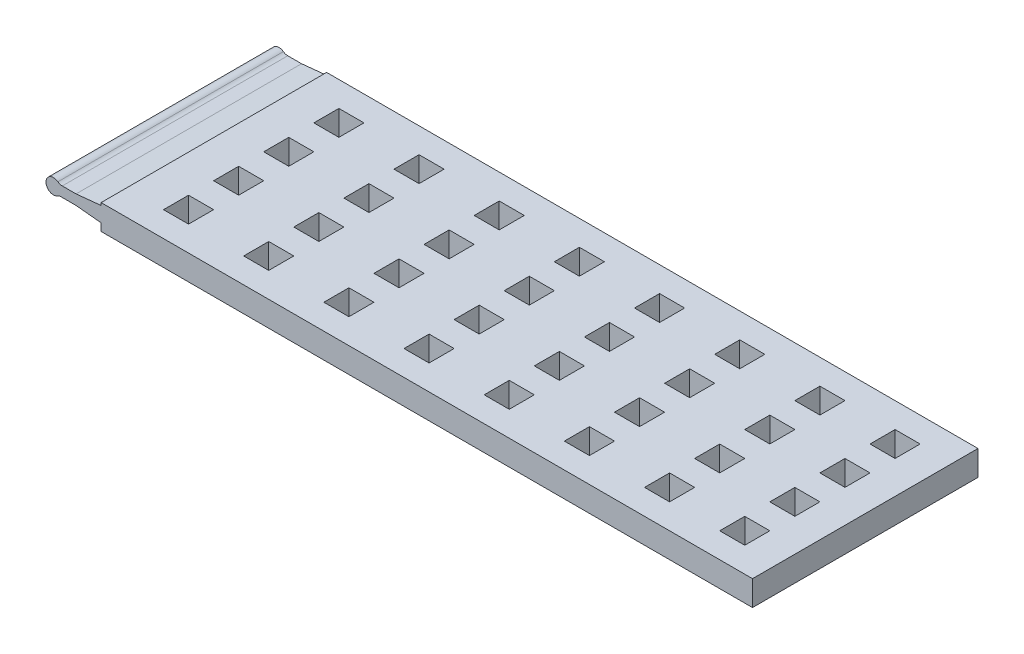
from build123d import *

# Parameters (mm, degrees)
SKETCH1_W           = 215
SKETCH1_H           = 90
BOSS_EXTRUDE1_DEPTH = 5
CUT_EXTRUDE2_DEPTH  = 146.187632354
SKETCH7_W           = 90
SKETCH7_H           = 10
BOSS_EXTRUDE3_DEPTH = 70
SKETCH8_W           = 10
SKETCH8_H           = 10
CUT_EXTRUDE4_DEPTH  = 38


with BuildPart() as part:
    # Sketch1 → Boss-Extrude1 (new, symmetric)
    with BuildSketch(Plane(origin=(0, 0, 0), x_dir=(1, 0, 0), z_dir=(0, 1, 0))):
        with Locations((6.317611065, 0.819935691)):
            Rectangle(SKETCH1_W, SKETCH1_H)
    extrude(amount=BOSS_EXTRUDE1_DEPTH, both=True)

    # Sketch3 → Cut-Extrude2 (cut, through all)
    with BuildSketch(Plane.XY.offset(44.180064309)):
        with BuildLine():
            Line((-101.182388935, -5), (-76.182388935, -5))
            Line((-76.182388935, -5), (-76.182388935, -2))
            Line((-76.182388935, -2), (-86.182388935, -1))
            Line((-86.182388935, -1), (-92.067313838, -1))
            ThreePointArc((-92.067313838, -1), (-92.876019978, -1.111056529), (-93.624851386, -1.436003747))
            ThreePointArc((-93.624851386, -1.436003747), (-98.180146552, 1.243963481), (-93.431421846, 3.563996253))
            ThreePointArc((-93.431421846, 3.563996253), (-92.600234286, 3.144478048), (-91.680454758, 3))
            Line((-91.680454758, 3), (-86.182388935, 3))
            Line((-86.182388935, 3), (-76.182388935, 4))
            Line((-76.182388935, 4), (-76.182388935, 5))
            Line((-76.182388935, 5), (-101.182388935, 5))
            Line((-101.182388935, 5), (-101.182388935, -5))
        make_face()
    extrude(amount=-CUT_EXTRUDE2_DEPTH, mode=Mode.SUBTRACT)

    # Sketch7 → Boss-Extrude3 (add)
    with BuildSketch(Plane(origin=(113.817611065, 0, 0), x_dir=(0, 0, -1), z_dir=(1, 0, 0))):
        with Locations((0.819935691, 0)):
            Rectangle(SKETCH7_W, SKETCH7_H)
    extrude(amount=BOSS_EXTRUDE3_DEPTH)

    # Sketch8 → Cut-Extrude4 (cut)
    with BuildSketch(Plane(origin=(0, 5, 0), x_dir=(1, 0, 0), z_dir=(0, 1, 0))):
        with Locations((-24.27998453, -29.180064309)):
            Rectangle(SKETCH8_W, SKETCH8_H)
        with Locations((-56.27998453, -29.180064309)):
            Rectangle(SKETCH8_W, SKETCH8_H)
        with Locations((7.72001547, -29.180064309)):
            Rectangle(SKETCH8_W, SKETCH8_H)
        with Locations((39.72001547, -29.180064309)):
            Rectangle(SKETCH8_W, SKETCH8_H)
        with Locations((71.72001547, -29.180064309)):
            Rectangle(SKETCH8_W, SKETCH8_H)
        with Locations((103.72001547, -29.180064309)):
            Rectangle(SKETCH8_W, SKETCH8_H)
        with Locations((135.72001547, -29.180064309)):
            Rectangle(SKETCH8_W, SKETCH8_H)
        with Locations((-24.27998453, -9.180064309)):
            Rectangle(SKETCH8_W, SKETCH8_H)
        with Locations((7.72001547, -9.180064309)):
            Rectangle(SKETCH8_W, SKETCH8_H)
        with Locations((39.72001547, -9.180064309)):
            Rectangle(SKETCH8_W, SKETCH8_H)
        with Locations((71.72001547, -9.180064309)):
            Rectangle(SKETCH8_W, SKETCH8_H)
        with Locations((103.72001547, -9.180064309)):
            Rectangle(SKETCH8_W, SKETCH8_H)
        with Locations((135.72001547, -9.180064309)):
            Rectangle(SKETCH8_W, SKETCH8_H)
        with Locations((-24.27998453, 10.819935691)):
            Rectangle(SKETCH8_W, SKETCH8_H)
        with Locations((7.72001547, 10.819935691)):
            Rectangle(SKETCH8_W, SKETCH8_H)
        with Locations((39.72001547, 10.819935691)):
            Rectangle(SKETCH8_W, SKETCH8_H)
        with Locations((71.72001547, 10.819935691)):
            Rectangle(SKETCH8_W, SKETCH8_H)
        with Locations((103.72001547, 10.819935691)):
            Rectangle(SKETCH8_W, SKETCH8_H)
        with Locations((135.72001547, 10.819935691)):
            Rectangle(SKETCH8_W, SKETCH8_H)
        with Locations((-24.27998453, 30.819935691)):
            Rectangle(SKETCH8_W, SKETCH8_H)
        with Locations((7.72001547, 30.819935691)):
            Rectangle(SKETCH8_W, SKETCH8_H)
        with Locations((39.72001547, 30.819935691)):
            Rectangle(SKETCH8_W, SKETCH8_H)
        with Locations((71.72001547, 30.819935691)):
            Rectangle(SKETCH8_W, SKETCH8_H)
        with Locations((103.72001547, 30.819935691)):
            Rectangle(SKETCH8_W, SKETCH8_H)
        with Locations((135.72001547, 30.819935691)):
            Rectangle(SKETCH8_W, SKETCH8_H)
        with Locations((-56.27998453, -9.180064309)):
            Rectangle(SKETCH8_W, SKETCH8_H)
        with Locations((-56.27998453, 10.819935691)):
            Rectangle(SKETCH8_W, SKETCH8_H)
        with Locations((-56.27998453, 30.819935691)):
            Rectangle(SKETCH8_W, SKETCH8_H)
    cut_extrude4 = extrude(amount=-CUT_EXTRUDE4_DEPTH, mode=Mode.SUBTRACT)

    # Mirror2: Cut-Extrude4 across plane
    add(cut_extrude4.mirror(Plane.ZY.offset(-150.72001547)), mode=Mode.SUBTRACT)


solid = part.part
